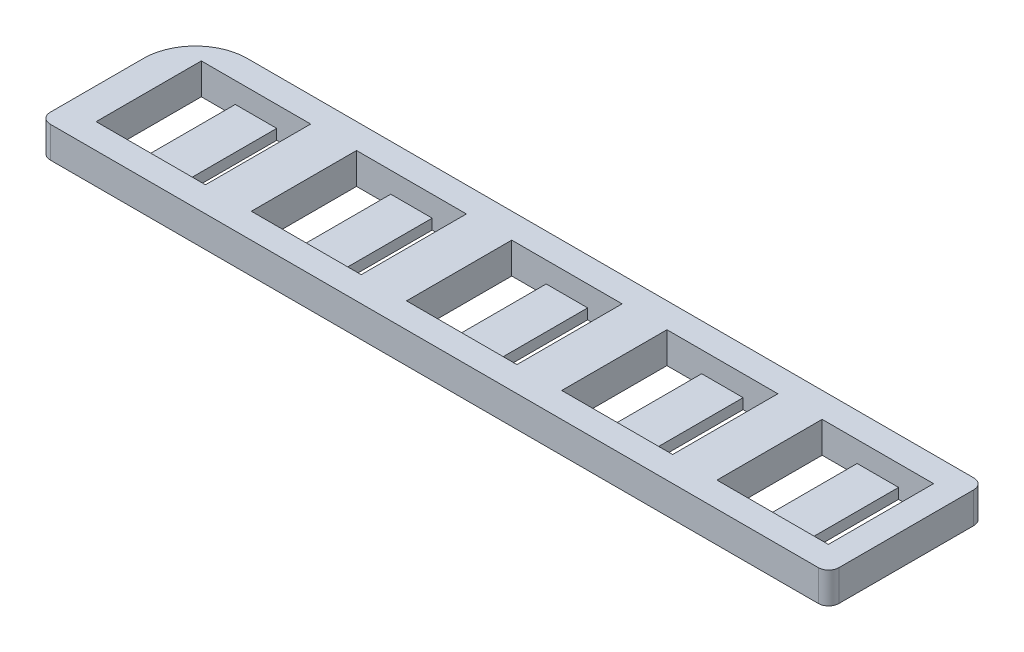
from build123d import *

# Parameters (mm, degrees)
SKETCH1_W           = 76.1
SKETCH1_H           = 15
BOSS_EXTRUDE1_DEPTH = 3
SKETCH1_3_W         = 4
SKETCH1_3_H         = 10.15
BOSS_EXTRUDE2_DEPTH = 1
FILLET1_R           = 5
FILLET2_R           = 1


with BuildPart() as part:
    # Sketch1 → Boss-Extrude1 (new body)
    with BuildSketch(Plane(origin=(0, 0, 0), x_dir=(1, 0, 0), z_dir=(0, 1, 0))):
        Rectangle(SKETCH1_W, SKETCH1_H)
        Polygon((-35.05, 5.075), (-31.775, 5.075), (-27.775, 5.075), (-24.5, 5.075), (-24.5, -5.075), (-27.775, -5.075), (-31.775, -5.075), (-35.05, -5.075), align=None, mode=Mode.SUBTRACT)
        Polygon((-20.075, 5.075), (-16.775, 5.075), (-12.775, 5.075), (-9.475, 5.075), (-9.475, -5.075), (-12.775, -5.075), (-16.775, -5.075), (-20.075, -5.075), align=None, mode=Mode.SUBTRACT)
        Polygon((-5.1, 5.075), (-1.775, 5.075), (2.225, 5.075), (5.55, 5.075), (5.55, -5.075), (2.225, -5.075), (-1.775, -5.075), (-5.1, -5.075), align=None, mode=Mode.SUBTRACT)
        Polygon((9.875, 5.075), (13.225, 5.075), (17.225, 5.075), (20.575, 5.075), (20.575, -5.075), (17.225, -5.075), (13.225, -5.075), (9.875, -5.075), align=None, mode=Mode.SUBTRACT)
        Polygon((24.85, 5.075), (28.225, 5.075), (32.225, 5.075), (35.6, 5.075), (35.6, -5.075), (32.225, -5.075), (28.225, -5.075), (24.85, -5.075), align=None, mode=Mode.SUBTRACT)
    extrude(amount=BOSS_EXTRUDE1_DEPTH)

    # Sketch1<3> → Boss-Extrude2 (add)
    with BuildSketch(Plane(origin=(0, 0, 0), x_dir=(1, 0, 0), z_dir=(0, 1, 0))):
        with Locations((-29.775, 0)):
            Rectangle(SKETCH1_3_W, SKETCH1_3_H)
        with Locations((-14.775, 0)):
            Rectangle(SKETCH1_3_W, SKETCH1_3_H)
        with Locations((0.225, 0)):
            Rectangle(SKETCH1_3_W, SKETCH1_3_H)
        with Locations((15.225, 0)):
            Rectangle(SKETCH1_3_W, SKETCH1_3_H)
        with Locations((30.225, 0)):
            Rectangle(SKETCH1_3_W, SKETCH1_3_H)
    extrude(amount=BOSS_EXTRUDE2_DEPTH)

    # Fillet1
    fillet1_edges = [part.edges().sort_by_distance(p)[0] for p in [
        (-38.05, 1.5, -7.5),
    ]]
    fillet(fillet1_edges, radius=FILLET1_R)

    # Fillet2
    fillet2_edges = [part.edges().sort_by_distance(p)[0] for p in [
        (38.05, 1.5, -7.5),
        (38.05, 1.5, 7.5),
        (-38.05, 1.5, 7.5),
    ]]
    fillet(fillet2_edges, radius=FILLET2_R)


solid = part.part
